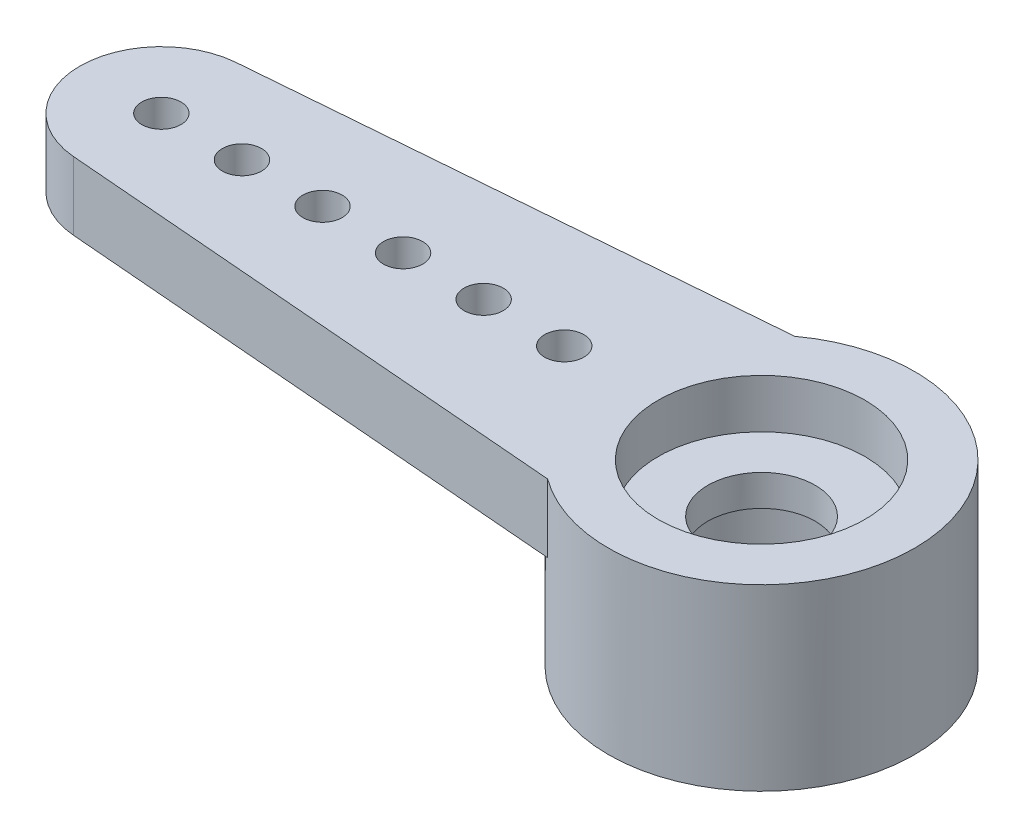
from build123d import *

# Parameters (mm, degrees)
EXTRUDE17_DEPTH = 1.6129
EXTRUDE19_START = -4.2291
SKETCH19_R      = 3.6195
EXTRUDE19_DEPTH = 4.2291
SKETCH20_R      = 0.46355
SKETCH20_R_2    = 1.27
EXTRUDE20_DEPTH = 18.054518091
SKETCH21_R      = 2.44475
EXTRUDE21_DEPTH = 1.1557
SKETCH22_R      = 2.286
EXTRUDE22_DEPTH = 2.3368


with BuildPart() as part:
    # Sketch18 → Extrude17 (new body)
    with BuildSketch(Plane(origin=(0, 0, 0), x_dir=(1, 0, 0), z_dir=(0, 1, 0))):
        with BuildLine():
            Line((-14.347205988, 1.923996328), (-2.13741415, 2.921))
            ThreePointArc((-2.13741415, 2.921), (3.6195, 0), (-2.13741415, -2.921))
            Line((-2.13741415, -2.921), (-14.347205988, -1.923996328))
            ThreePointArc((-14.347205988, -1.923996328), (-16.1205, 0), (-14.347205988, 1.923996328))
        make_face()
    extrude(amount=EXTRUDE17_DEPTH)

    # Sketch19 → Extrude19 (add)
    with BuildSketch(Plane(origin=(0, 1.6129, 0), x_dir=(1, 0, 0), z_dir=(0, 1, 0)).offset(EXTRUDE19_START)):
        with Locations(Location((0, 0, 0), (0, 0, 126.194447475))):
            Circle(SKETCH19_R)
    extrude(amount=EXTRUDE19_DEPTH)

    # Sketch20 → Extrude20 (cut, through all)
    with BuildSketch(Plane(origin=(0, 1.6129, 0), x_dir=(1, 0, 0), z_dir=(0, 1, 0))):
        with Locations(Location((-14.1901, 0, 0), (0, 0, 270))):
            Circle(SKETCH20_R)
        with Locations(Location((0, 0, 0), (0, 0, 270))):
            Circle(SKETCH20_R_2)
        with Locations(Location((-4.6651, 0, 0), (0, 0, 270))):
            Circle(SKETCH20_R)
        with Locations(Location((-6.5701, 0, 0), (0, 0, 270))):
            Circle(SKETCH20_R)
        with Locations(Location((-8.4751, 0, 0), (0, 0, 270))):
            Circle(SKETCH20_R)
        with Locations(Location((-10.3801, 0, 0), (0, 0, 270))):
            Circle(SKETCH20_R)
        with Locations(Location((-12.2851, 0, 0), (0, 0, 270))):
            Circle(SKETCH20_R)
    extrude(amount=-EXTRUDE20_DEPTH, mode=Mode.SUBTRACT)

    # Sketch21 → Extrude21 (cut)
    with BuildSketch(Plane(origin=(0, 1.6129, 0), x_dir=(1, 0, 0), z_dir=(0, 1, 0))):
        with Locations(Location((0, 0, 0), (0, 0, 270))):
            Circle(SKETCH21_R)
    extrude(amount=-EXTRUDE21_DEPTH, mode=Mode.SUBTRACT)

    # Sketch22 → Extrude22 (cut)
    with BuildSketch(Plane.XZ.offset(2.6162)):
        with Locations(Location((0, 0, 0), (0, 0, 270))):
            Circle(SKETCH22_R)
    extrude(amount=-EXTRUDE22_DEPTH, mode=Mode.SUBTRACT)


solid = part.part
